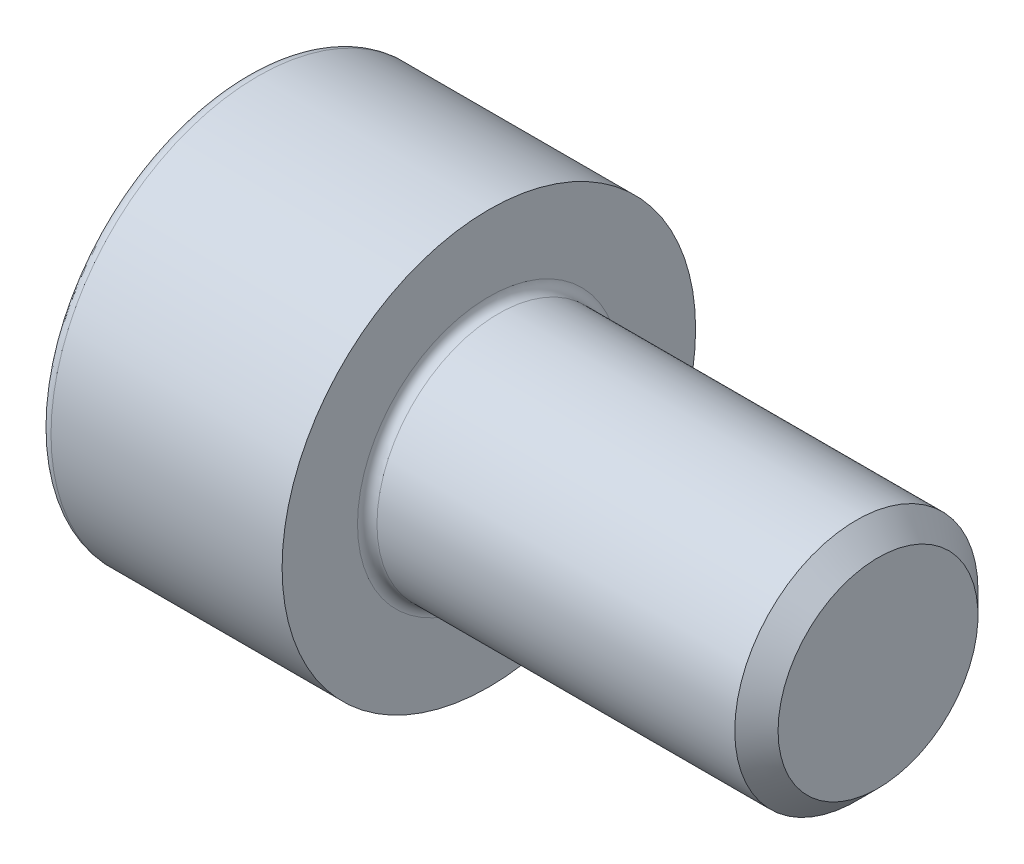
from build123d import *

# Parameters (mm, degrees)
FILLET1_R   = 0.2
FILLET2_R   = 0.25
HEX_2_DEPTH = 2.5


with BuildPart() as part:
    # BodySke → BaseBody (revolve)
    with BuildSketch(Plane.XY, mode=Mode.PRIVATE) as basebody_sk:
        Polygon((0, 0), (0, 4.25), (5, 4.25), (5, 2.5), (12.555, 2.5), (13, 2.055), (13, 0), align=None)
    revolve(basebody_sk.sketch.rotate(Axis((0, 0, 0), (1, 0, 0)), 90), axis=Axis((0, 0, 0), (1, 0, 0)))

    # Fillet1
    fillet1_edges = [part.edges().sort_by_distance(p)[0] for p in [
        (5, 0, -2.5),
    ]]
    fillet(fillet1_edges, radius=FILLET1_R)

    # Fillet2
    fillet2_edges = [part.edges().sort_by_distance(p)[0] for p in [
        (0, 0, -4.25),
    ]]
    fillet(fillet2_edges, radius=FILLET2_R)

    # HexSke → Hex 2 (cut)
    with BuildSketch(Plane(origin=(0, 0, 0), x_dir=(0, 0, -1), z_dir=(1, 0, 0))):
        Polygon((0, 2.309401077), (-2, 1.154700538), (-2, -1.154700538), (0, -2.309401077), (2, -1.154700538), (2, 1.154700538), align=None)
    extrude(amount=HEX_2_DEPTH, mode=Mode.SUBTRACT)

    # Hex-PreBroachSke → Hex-PreBroach (revolve, cut)
    with BuildSketch(Plane.XY, mode=Mode.PRIVATE) as hex_prebroach_sk:
        Polygon((0, 0), (0, 2), (2.5, 2), (3.654700538, 0), align=None)
    revolve(hex_prebroach_sk.sketch.rotate(Axis((0, 0, 0), (1, 0, 0)), 270), axis=Axis((0, 0, 0), (1, 0, 0)), mode=Mode.SUBTRACT)


solid = part.part
